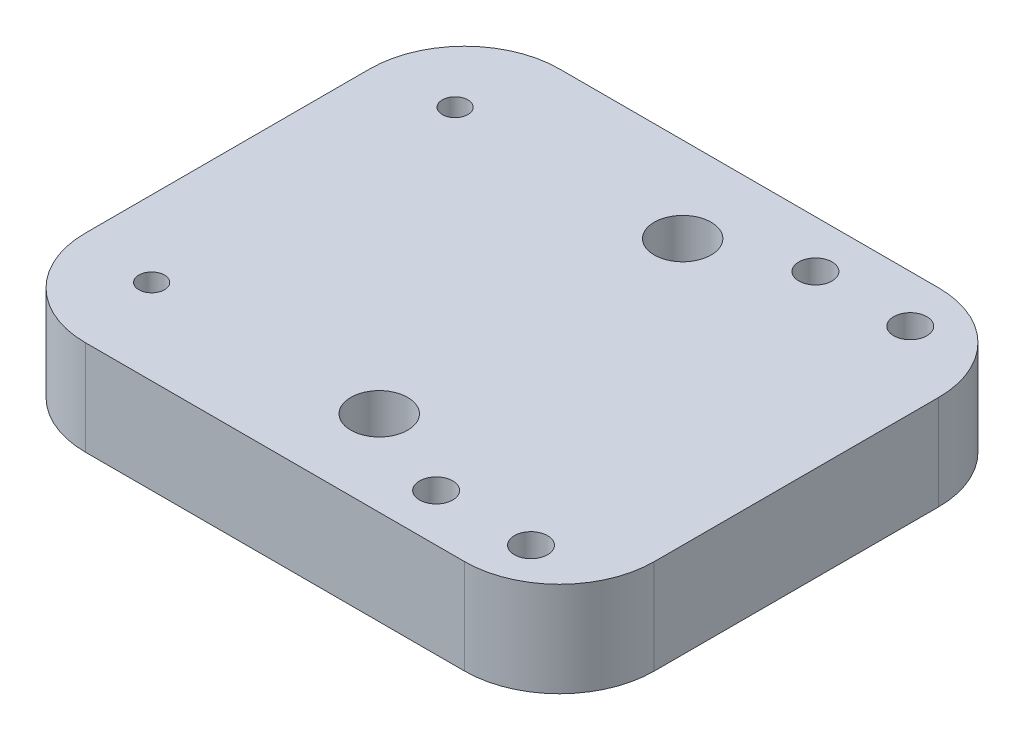
from build123d import *

# Parameters (mm, degrees)
SKETCH1_W           = 60
SKETCH1_H           = 50
BOSS_EXTRUDE1_DEPTH = 10
SKETCH2_R           = 1.35
CUT_EXTRUDE1_DEPTH  = 79.74007874
SKETCH3_R           = 1.75
CUT_EXTRUDE2_DEPTH  = 79.74007874
FILLET1_R           = 10
SKETCH4_R           = 3
CUT_EXTRUDE3_DEPTH  = 5


with BuildPart() as part:
    # Sketch1 → Boss-Extrude1 (new body)
    with BuildSketch(Plane(origin=(0, 0, 0), x_dir=(1, 0, 0), z_dir=(0, 1, 0))):
        with Locations((30, 25)):
            Rectangle(SKETCH1_W, SKETCH1_H)
    extrude(amount=BOSS_EXTRUDE1_DEPTH)

    # Sketch2 → Cut-Extrude1 (cut, through all)
    with BuildSketch(Plane(origin=(0, 10, 0), x_dir=(1, 0, 0), z_dir=(0, 1, 0))):
        with Locations(Location((8, 41, 0), (0, 0, 270))):
            Circle(SKETCH2_R)
        with Locations(Location((8, 9, 0), (0, 0, 270))):
            Circle(SKETCH2_R)
        with Locations(Location((32, 9, 0), (0, 0, 270))):
            Circle(SKETCH2_R)
        with Locations(Location((32, 41, 0), (0, 0, 270))):
            Circle(SKETCH2_R)
    extrude(amount=-CUT_EXTRUDE1_DEPTH, mode=Mode.SUBTRACT)

    # Sketch3 → Cut-Extrude2 (cut, through all)
    with BuildSketch(Plane(origin=(0, 10, 0), x_dir=(1, 0, 0), z_dir=(0, 1, 0))):
        with Locations(Location((42, 45, 0), (0, 0, 270))):
            Circle(SKETCH3_R)
        with Locations(Location((52, 45, 0), (0, 0, 270))):
            Circle(SKETCH3_R)
        with Locations(Location((52, 5, 0), (0, 0, 270))):
            Circle(SKETCH3_R)
        with Locations(Location((42, 5, 0), (0, 0, 270))):
            Circle(SKETCH3_R)
    extrude(amount=-CUT_EXTRUDE2_DEPTH, mode=Mode.SUBTRACT)

    # Fillet1
    fillet1_edges = [part.edges().sort_by_distance(p)[0] for p in [
        (0, 5, -50),
        (60, 5, -50),
        (60, 5, 0),
        (0, 5, 0),
    ]]
    fillet(fillet1_edges, radius=FILLET1_R)

    # Sketch4 → Cut-Extrude3 (cut)
    with BuildSketch(Plane(origin=(0, 10, 0), x_dir=(1, 0, 0), z_dir=(0, 1, 0))):
        with Locations(Location((32, 41, 0), (0, 0, 270))):
            Circle(SKETCH4_R)
        with Locations(Location((32, 9, 0), (0, 0, 270))):
            Circle(SKETCH4_R)
    extrude(amount=-CUT_EXTRUDE3_DEPTH, mode=Mode.SUBTRACT)


solid = part.part
